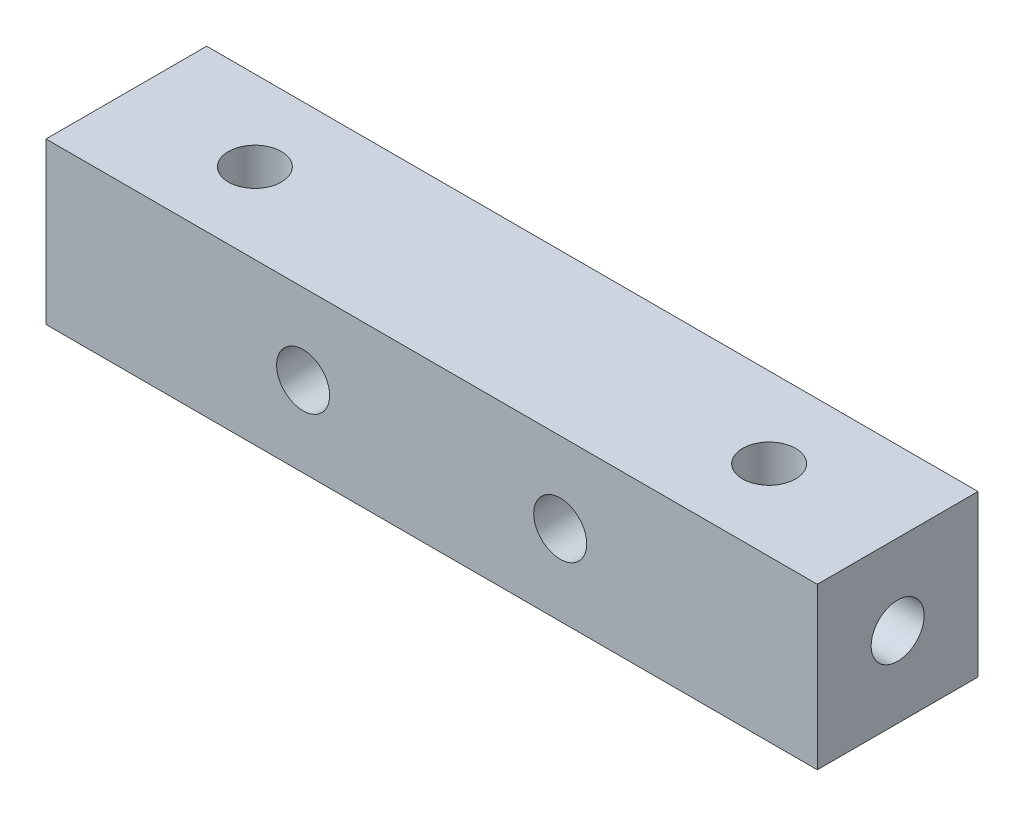
from build123d import *

# Parameters (mm, degrees)
SKETCH_1_W         = 48
SKETCH_1_H         = 10
EXTRUDE_1_DEPTH    = 10
HOLE_WIZARD_M4_1_D = 3.3
HOLE_WIZARD_M4_2_D = 3.3
HOLE_WIZARD_M4_3_D = 3.3
HOLE_WIZARD_M4_4_D = 3.3
HOLE_WIZARD_M4_5_D = 3.3


with BuildPart() as part:
    # 草图1 → 凸台-拉伸1 (new body)
    with BuildSketch(Plane.XY):
        Rectangle(SKETCH_1_W, SKETCH_1_H)
    extrude(amount=EXTRUDE_1_DEPTH)

    # M4 螺纹孔的螺纹孔钻头1 (through all)
    with Locations(Plane(origin=(-24, 0, 5), x_dir=(0, 0, -1), z_dir=(-1, 0, 0))):
        with Locations((0, 0)):
            Hole(HOLE_WIZARD_M4_1_D / 2)

    # M4 螺纹孔的螺纹孔钻头2 (through all)
    with Locations(Plane(origin=(8, 0, 0), x_dir=(-1, 0, 0), z_dir=(0, 0, -1))):
        with Locations((0, 0)):
            Hole(HOLE_WIZARD_M4_2_D / 2)

    # M4 螺纹孔的螺纹孔钻头3 (through all)
    with Locations(Plane(origin=(-8, 0, 0), x_dir=(-1, 0, 0), z_dir=(0, 0, -1))):
        with Locations((0, 0)):
            Hole(HOLE_WIZARD_M4_3_D / 2)

    # M4 螺纹孔的螺纹孔钻头4 (through all)
    with Locations(Plane(origin=(16, 5, 5), x_dir=(1, 0, 0), z_dir=(0, 1, 0))):
        with Locations((0, 0)):
            Hole(HOLE_WIZARD_M4_4_D / 2)

    # M4 螺纹孔的螺纹孔钻头5 (through all)
    with Locations(Plane(origin=(-16, 5, 5), x_dir=(1, 0, 0), z_dir=(0, 1, 0))):
        with Locations((0, 0)):
            Hole(HOLE_WIZARD_M4_5_D / 2)


solid = part.part
